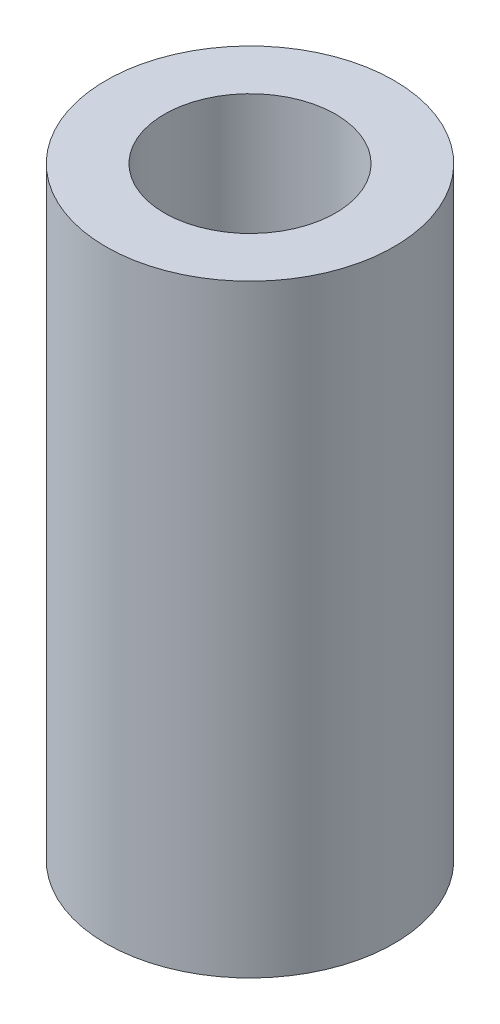
from build123d import *

# Parameters (mm, degrees)
SWEEP1_PROFILE_R     = 13.462
CUT_SWEEP1_PROFILE_R = 8.001


with BuildPart() as part:
    # Sweep1: sweep along a path in Sketch1
    with BuildLine(Plane.XY) as sweep1_path:
        Line((0, 0), (0, 56.388))
    # Sweep1 profile (on start of the path) → Sweep1 (sweep)
    with BuildSketch(Plane.ZX):
        Circle(SWEEP1_PROFILE_R)
    sweep(path=sweep1_path.line)

    # Cut-Sweep1: sweep along a path in Sketch1<3>
    with BuildLine(Plane.XY) as cut_sweep1_path:
        Line((0, 0), (0, 56.388))
    # Cut-Sweep1 profile (on start of the path) → Cut-Sweep1 (sweep, cut)
    with BuildSketch(Plane.ZX):
        Circle(CUT_SWEEP1_PROFILE_R)
    sweep(path=cut_sweep1_path.line, mode=Mode.SUBTRACT)


solid = part.part
